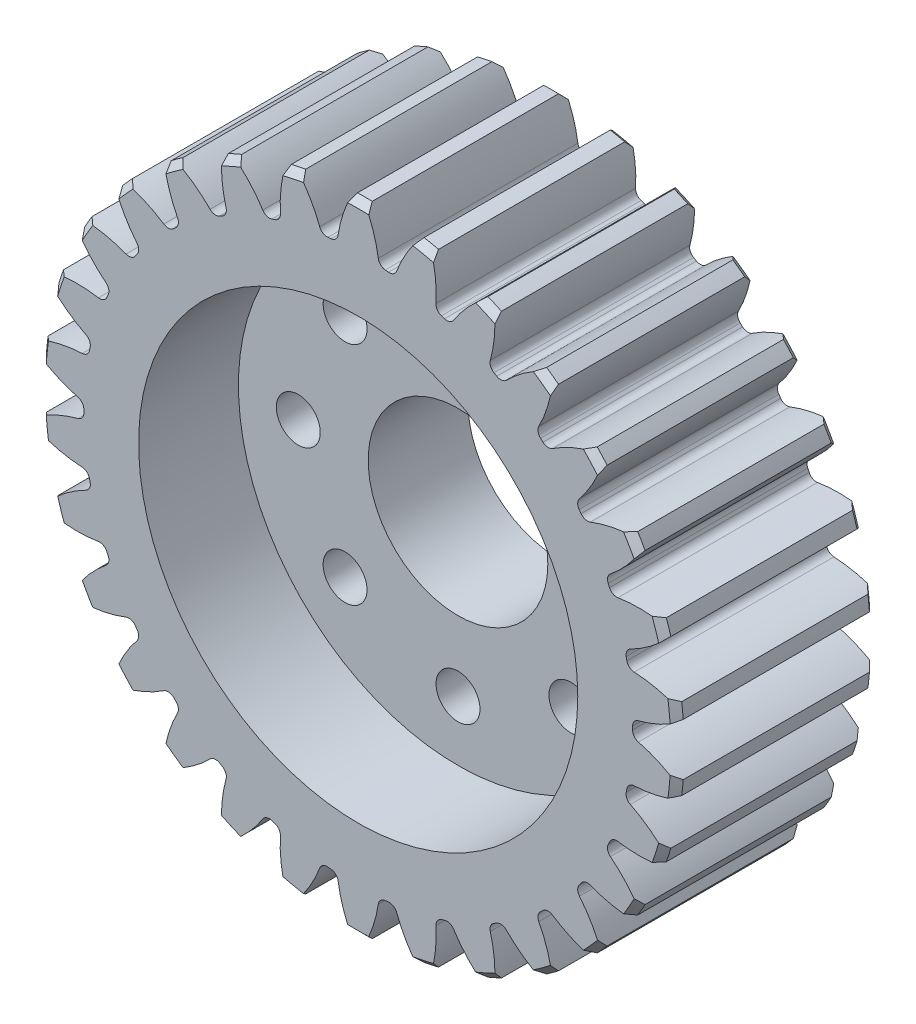
from build123d import *

# Parameters (mm, degrees)
BOSS_EXTRUDE1_DEPTH            = 10
BOSS_EXTRUDE1_DEPTH_BACK       = 10
SKETCH3_R                      = 16
SKETCH5_W                      = 10
SKETCH5_H                      = 3.5
SKETCH5_W_2                    = 20
SKETCH5_H_2                    = 4
FILLET2_R                      = 0.335505036
CHAMFER1_SIZE                  = 0.335505036
CUT_EXTRUDE1_DEPTH             = 25.738633754
FILLET1_R                      = 0.392699082
CIRPATTERN1_COUNT              = 30
FILLET1_OF_CIRPATTERN1_R       = 0.392699082
M2_CLEARANCE_HOLE1_D           = 2.2
M2_CLEARANCE_HOLE1_CSINK_D     = 2.25
M2_CLEARANCE_HOLE1_CSINK_ANGLE = 90
CUT_EXTRUDE2_DEPTH             = 25.70417038
CUT_EXTRUDE2_DEPTH_BACK        = 25.70417038
SKETCH10_R                     = 4.5
CUT_EXTRUDE3_START             = 10
SKETCH11_R                     = 11
CUT_EXTRUDE3_DEPTH             = 5


with BuildPart() as part:
    # Sketch3 → Boss-Extrude1 (new, two sides: drawn at the far end of the back side and taken through both)
    with BuildSketch(Plane.XY.offset(-BOSS_EXTRUDE1_DEPTH_BACK)):
        Circle(SKETCH3_R)
    extrude(amount=BOSS_EXTRUDE1_DEPTH + BOSS_EXTRUDE1_DEPTH_BACK)

    # Sketch5 → Cut-Revolve1 (revolve, cut)
    with BuildSketch(Plane(origin=(0, 0, 0), x_dir=(0, 0, -1), z_dir=(1, 0, 0)), mode=Mode.PRIVATE) as cut_revolve1_sk:
        with Locations((-5, 14.25)):
            Rectangle(SKETCH5_W, SKETCH5_H)
        with Locations((0, 2)):
            Rectangle(SKETCH5_W_2, SKETCH5_H_2)
    revolve(cut_revolve1_sk.sketch.rotate(Axis((0, 0, 10), (0, 0, -1)), 180), axis=Axis((0, 0, 10), (0, 0, -1)), mode=Mode.SUBTRACT)

    # Fillet2
    fillet2_edges = [part.edges().sort_by_distance(p)[0] for p in [
        (0, 12.5, 0),
    ]]
    fillet(fillet2_edges, radius=FILLET2_R)

    # Chamfer1
    chamfer1_edges = [part.edges().sort_by_distance(p)[0] for p in [
        (0, 4, 10),
        (0, 4, -10),
        (-16, 0, 0),
        (0, 12.5, 10),
        (-16, 0, -10),
    ]]
    chamfer(chamfer1_edges, length=CHAMFER1_SIZE)

    # Sketch4 → Cut-Extrude1 (cut, symmetric)
    with BuildSketch(Plane.XY):
        with BuildLine():
            Line((13.744391126, 0.392699082), (13.744391126, -0.392699082))
            ThreePointArc((13.744391126, -0.392699082), (14.887100169, -0.748713615), (15.946661901, -1.305363632))
            ThreePointArc((15.946661901, -1.305363632), (16, 0), (15.946661901, 1.305363632))
            ThreePointArc((15.946661901, 1.305363632), (14.887100169, 0.748713615), (13.744391126, 0.392699082))
        make_face()
    cut_extrude1 = extrude(amount=CUT_EXTRUDE1_DEPTH, both=True, mode=Mode.SUBTRACT)

    # Fillet1
    fillet1_edges = [part.edges().sort_by_distance(p)[0] for p in [
        (13.744391126, 0.392699082, -5),
        (13.744391126, -0.392699082, -5),
    ]]
    fillet(fillet1_edges, radius=FILLET1_R)

    # CirPattern1: Cut-Extrude1 ×30 about axis
    cirpattern1_axis = Axis((0, 0, 0), (0, 0, 1))
    for i in range(1, CIRPATTERN1_COUNT):
        add(cut_extrude1.rotate(cirpattern1_axis, i * 360 / CIRPATTERN1_COUNT), mode=Mode.SUBTRACT)

    # Fillet1 of CirPattern1
    fillet1_of_cirpattern1_edges = [part.edges().sort_by_distance(p)[0] for p in [
        (13.362396474, 3.241737263, -5),
        (13.525689934, 2.473501934, -5),
        (12.396400975, 5.94909597, -5),
        (12.715851188, 5.231599046, -5),
        (10.88862327, 8.396450637, -5),
        (11.350268727, 7.761050175, -5),
        (8.904960478, 10.476840119, -5),
        (9.488625059, 9.95130617, -5),
        (6.532108182, 12.099341416, -5),
        (7.212282944, 11.706642334, -5),
        (3.873771415, 13.193043433, -5),
        (4.620729456, 12.950342053, -5),
        (1.046132248, 13.710146145, -5),
        (1.827227918, 13.628049682, -5),
        (-1.827227918, 13.628049682, -5),
        (-1.046132248, 13.710146145, -5),
        (-4.620729456, 12.950342053, -5),
        (-3.873771415, 13.193043433, -5),
        (-7.212282944, 11.706642334, -5),
        (-6.532108182, 12.099341416, -5),
        (-9.488625059, 9.95130617, -5),
        (-8.904960478, 10.476840119, -5),
        (-11.350268727, 7.761050175, -5),
        (-10.88862327, 8.396450637, -5),
        (-12.715851188, 5.231599046, -5),
        (-12.396400975, 5.94909597, -5),
        (-13.525689934, 2.473501934, -5),
        (-13.362396474, 3.241737263, -5),
        (-13.744391126, -0.392699082, -5),
        (-13.744391126, 0.392699082, -5),
        (-13.362396474, -3.241737263, -5),
        (-13.525689934, -2.473501934, -5),
        (-12.396400975, -5.94909597, -5),
        (-12.715851188, -5.231599046, -5),
        (-10.88862327, -8.396450637, -5),
        (-11.350268727, -7.761050175, -5),
        (-8.904960478, -10.476840119, -5),
        (-9.488625059, -9.95130617, -5),
        (-6.532108182, -12.099341416, -5),
        (-7.212282944, -11.706642334, -5),
        (-3.873771415, -13.193043433, -5),
        (-4.620729456, -12.950342053, -5),
        (-1.046132248, -13.710146145, -5),
        (-1.827227918, -13.628049682, -5),
        (1.827227918, -13.628049682, -5),
        (1.046132248, -13.710146145, -5),
        (4.620729456, -12.950342053, -5),
        (3.873771415, -13.193043433, -5),
        (7.212282944, -11.706642334, -5),
        (6.532108182, -12.099341416, -5),
        (9.488625059, -9.95130617, -5),
        (8.904960478, -10.476840119, -5),
        (11.350268727, -7.761050175, -5),
        (10.88862327, -8.396450637, -5),
        (12.715851188, -5.231599046, -5),
        (12.396400975, -5.94909597, -5),
        (13.525689934, -2.473501934, -5),
        (13.362396474, -3.241737263, -5),
    ]]
    fillet(fillet1_of_cirpattern1_edges, radius=FILLET1_OF_CIRPATTERN1_R)

    # Split1
    split(bisect_by=Plane.XY, keep=Keep.BOTTOM)

    # M2 Clearance Hole1 (through all)
    with Locations(Plane.XY):
        with Locations((-5.656854249, -5.656854249), (-8, 0), (-5.656854249, 5.656854249), (0, 8), (5.656854249, 5.656854249), (8, 0), (5.656854249, -5.656854249), (0, -8)):
            CounterSinkHole(M2_CLEARANCE_HOLE1_D / 2, M2_CLEARANCE_HOLE1_CSINK_D / 2, counter_sink_angle=M2_CLEARANCE_HOLE1_CSINK_ANGLE)

    # Sketch10 → Cut-Extrude2 (cut, two sides: drawn at the far end of the back side and taken through both)
    with BuildSketch(Plane.XY.offset(-CUT_EXTRUDE2_DEPTH_BACK)):
        Circle(SKETCH10_R)
    extrude(amount=CUT_EXTRUDE2_DEPTH + CUT_EXTRUDE2_DEPTH_BACK, mode=Mode.SUBTRACT)

    # Sketch11 → Cut-Extrude3 (cut)
    with BuildSketch(Plane(origin=(7.419230002, 11.925427767, -10), x_dir=(1, 0, 0), z_dir=(0, 0, 1)).offset(CUT_EXTRUDE3_START)):
        with Locations((-7.419230002, -11.925427767)):
            Circle(SKETCH11_R)
    extrude(amount=-CUT_EXTRUDE3_DEPTH, mode=Mode.SUBTRACT)


solid = part.part
